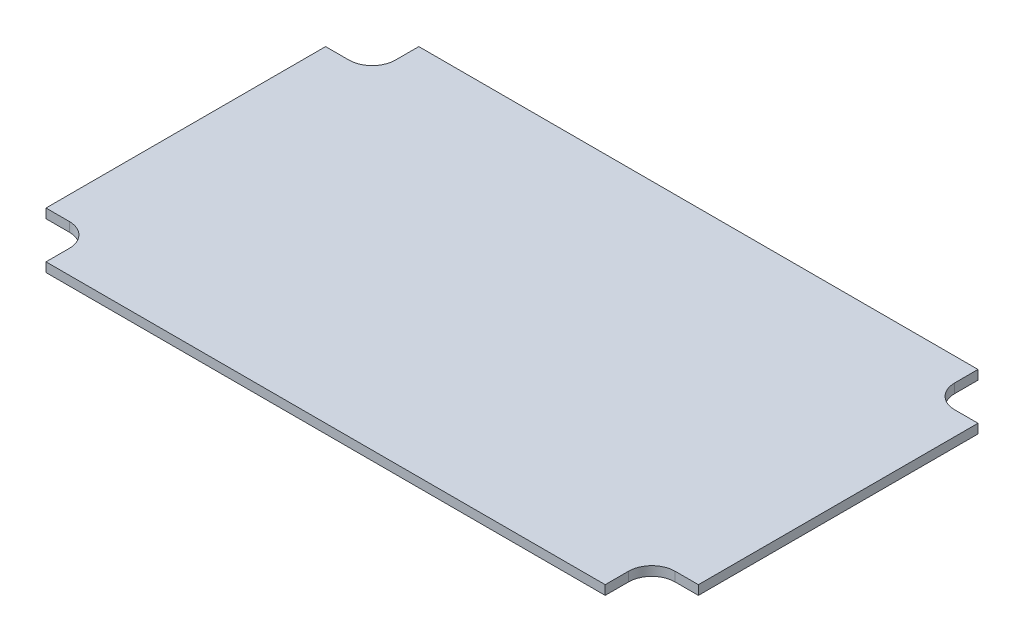
from build123d import *

# Parameters (mm, degrees)
SKETCH1_W           = 2
SKETCH1_H           = 56
SKETCH1_W_2         = 116
SKETCH1_H_2         = 2
BOSS_EXTRUDE8_DEPTH = 2
FILLET1_R           = 5


with BuildPart() as part:
    # Sketch1 → Boss-Extrude8 (new body)
    with BuildSketch(Plane(origin=(0, 0, 0), x_dir=(1, 0, 0), z_dir=(0, 1, 0))):
        with Locations((-69, 0)):
            Rectangle(SKETCH1_W, SKETCH1_H)
        Polygon((-58, 38), (-58, 40), (-60, 40), (-60, 30), (-70, 30), (-70, 28), (-68, 28), (-58, 28), align=None)
        with Locations((0, 39)):
            Rectangle(SKETCH1_W_2, SKETCH1_H_2)
        Polygon((68, -28), (68, 28), (58, 28), (58, 38), (-58, 38), (-58, 28), (-68, 28), (-68, -28), (-58, -28), (-58, -38), (58, -38), (58, -28), align=None)
        Polygon((70, 28), (70, 30), (60, 30), (60, 40), (58, 40), (58, 38), (58, 28), (68, 28), align=None)
        with Locations((69, 0)):
            Rectangle(SKETCH1_W, SKETCH1_H)
        Polygon((70, -30), (70, -28), (68, -28), (58, -28), (58, -38), (58, -40), (60, -40), (60, -30), align=None)
        with Locations((0, -39)):
            Rectangle(SKETCH1_W_2, SKETCH1_H_2)
        Polygon((-58, -40), (-58, -38), (-58, -28), (-68, -28), (-70, -28), (-70, -30), (-60, -30), (-60, -40), align=None)
    extrude(amount=BOSS_EXTRUDE8_DEPTH)

    # Fillet1
    fillet1_edges = [part.edges().sort_by_distance(p)[0] for p in [
        (60, 1, 30),
        (-60, 1, 30),
        (-60, 1, -30),
        (60, 1, -30),
    ]]
    fillet(fillet1_edges, radius=FILLET1_R)


solid = part.part
